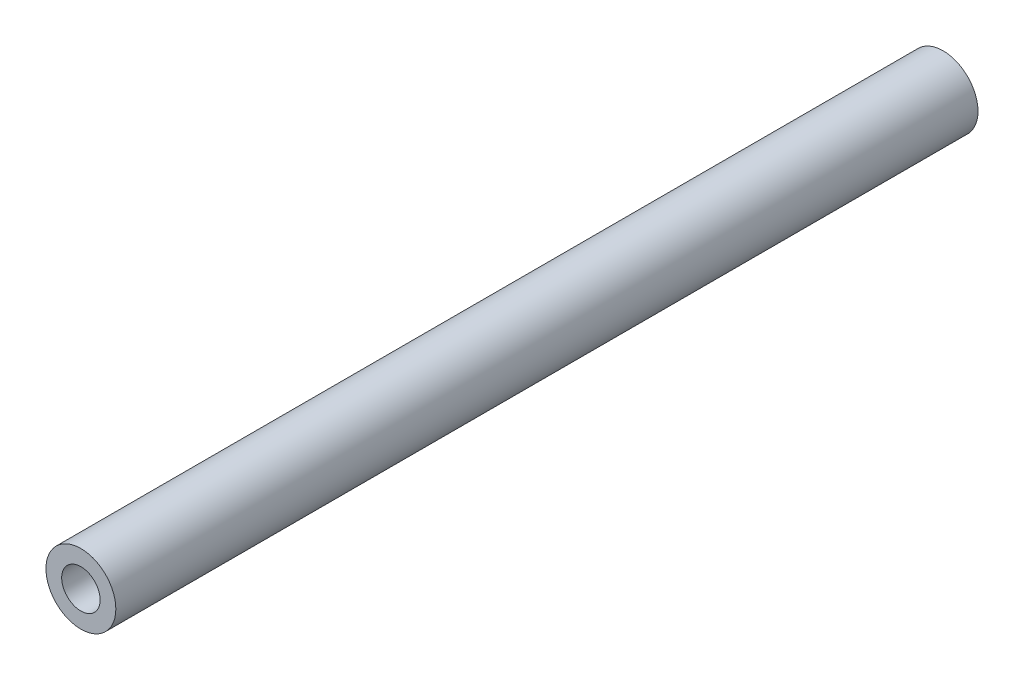
from build123d import *

# Parameters (mm, degrees)
SKETCH_1_R         = 3
EXTRUDE_1_DEPTH    = 74
HOLE_WIZARD_M4_1_D = 3.3


with BuildPart() as part:
    # 草图1 → 凸台-拉伸1 (new body)
    with BuildSketch(Plane.XY):
        Circle(SKETCH_1_R)
    extrude(amount=EXTRUDE_1_DEPTH)

    # M4 螺纹孔1 (through all)
    with Locations(Plane.XY.offset(74)):
        with Locations((0, 0)):
            Hole(HOLE_WIZARD_M4_1_D / 2)


solid = part.part
